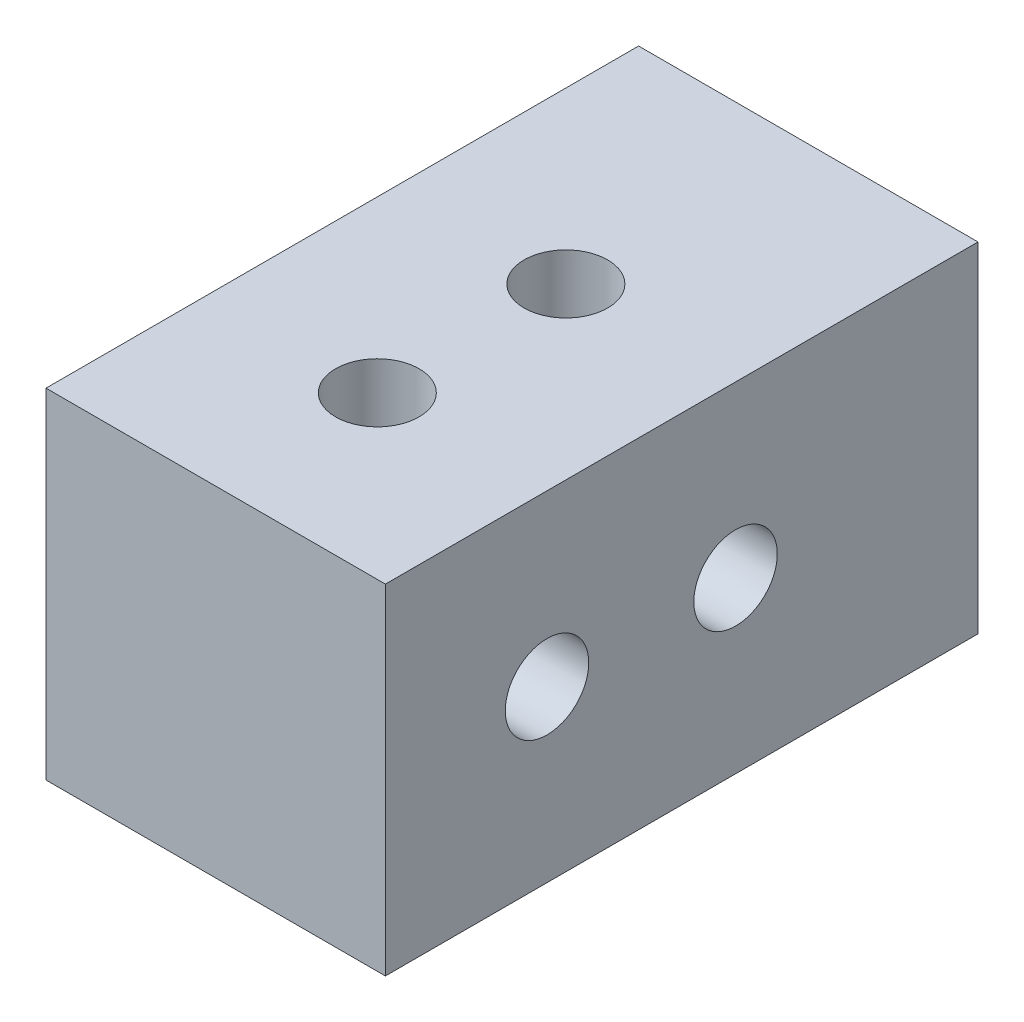
from build123d import *

# Parameters (mm, degrees)
SKETCH_1_W          = 12.6
SKETCH_1_H          = 12.6
EXTRUDE_1_DEPTH     = 22
CUT_EXTRUDE_1_REACH = 28.124
SKETCH_2_R          = 1.55
CUT_EXTRUDE_2_REACH = 28.124
SKETCH_3_R          = 1.55


with BuildPart() as part:
    # 草图1 → 凸台-拉伸1 (new body)
    with BuildSketch(Plane.XY):
        Rectangle(SKETCH_1_W, SKETCH_1_H)
    extrude(amount=EXTRUDE_1_DEPTH)

    # 草图2 → 切除-拉伸1 (cut, up to next)
    with BuildSketch(Plane(origin=(0, 6.3, 0), x_dir=(1, 0, 0), z_dir=(0, 1, 0)), mode=Mode.PRIVATE) as cut_extrude_1_sk1:
        with Locations(Location((0, -9, 0), (0, 0, 270))):
            Circle(SKETCH_2_R)
    cut_extrude_1_tool1 = extrude(cut_extrude_1_sk1.sketch, amount=-CUT_EXTRUDE_1_REACH, mode=Mode.PRIVATE) & part.part
    # 草图2 → 切除-拉伸1 (cut, up to next)
    with BuildSketch(Plane(origin=(0, 6.3, 0), x_dir=(1, 0, 0), z_dir=(0, 1, 0)), mode=Mode.PRIVATE) as cut_extrude_1_sk2:
        with Locations(Location((0, -16, 0), (0, 0, 270))):
            Circle(SKETCH_2_R)
    cut_extrude_1_tool2 = extrude(cut_extrude_1_sk2.sketch, amount=-CUT_EXTRUDE_1_REACH, mode=Mode.PRIVATE) & part.part
    add(cut_extrude_1_tool1.solids().sort_by_distance((0, 6.3, 9))[0], mode=Mode.SUBTRACT)
    add(cut_extrude_1_tool2.solids().sort_by_distance((0, 6.3, 16))[0], mode=Mode.SUBTRACT)

    # 切除-拉伸2: up to this face of the body (flat: up to its plane)
    cut_extrude_2_end = Plane(part.part.faces().sort_by_distance((6.3, 0, 11))[0])
    # 草图3 → 切除-拉伸2 (cut, up to the picked face)
    with BuildSketch(Plane.ZY.offset(6.3), mode=Mode.PRIVATE) as cut_extrude_2_sk1:
        with Locations((9, 0)):
            Circle(SKETCH_3_R)
    cut_extrude_2_tool1 = split(extrude(cut_extrude_2_sk1.sketch, amount=-CUT_EXTRUDE_2_REACH, mode=Mode.PRIVATE), bisect_by=cut_extrude_2_end, keep=Keep.BOTH, mode=Mode.PRIVATE)
    # 草图3 → 切除-拉伸2 (cut, up to the picked face)
    with BuildSketch(Plane.ZY.offset(6.3), mode=Mode.PRIVATE) as cut_extrude_2_sk2:
        with Locations((16, 0)):
            Circle(SKETCH_3_R)
    cut_extrude_2_tool2 = split(extrude(cut_extrude_2_sk2.sketch, amount=-CUT_EXTRUDE_2_REACH, mode=Mode.PRIVATE), bisect_by=cut_extrude_2_end, keep=Keep.BOTH, mode=Mode.PRIVATE)
    add(cut_extrude_2_tool1.solids().sort_by(Axis((-6.3, 0, 9), (1, 0, 0)))[0], mode=Mode.SUBTRACT)
    add(cut_extrude_2_tool2.solids().sort_by(Axis((-6.3, 0, 16), (1, 0, 0)))[0], mode=Mode.SUBTRACT)


solid = part.part
